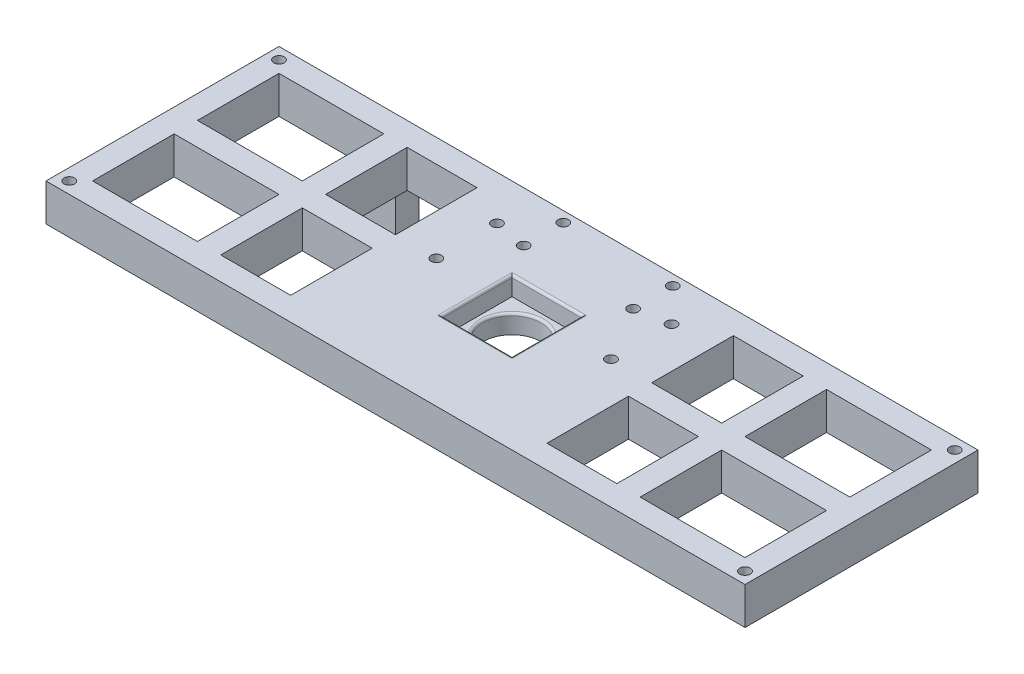
from build123d import *

# Parameters (mm, degrees)
SKETCH_1_W           = 300
SKETCH_1_H           = 100
EXTRUDE_1_DEPTH      = 16
SKETCH_2_W           = 30
SKETCH_2_H           = 30
CUT_EXTRUDE_1_DEPTH  = 8
SKETCH_3_R           = 12.5
CUT_EXTRUDE_2_DEPTH  = 14
CUT_EXTRUDE_3_REACH  = 318.632
SKETCH_4_W           = 50
SKETCH_4_H           = 35
SKETCH_7_W           = 35
SKETCH_7_H           = 16
EXTRUDE_2_DEPTH      = 20
SKETCH_8_W           = 35
SKETCH_8_H           = 16
EXTRUDE_3_DEPTH      = 20
SKETCH_9_W           = 20
SKETCH_9_H           = 10
EXTRUDE_4_DEPTH      = 25
FILLET_1_R           = 1
FILLET_2_R           = 1
SKETCH_13_W          = 35
SKETCH_13_H          = 16
EXTRUDE_6_DEPTH      = 4
SKETCH_14_W          = 35
SKETCH_14_H          = 16
EXTRUDE_7_DEPTH      = 4
SKETCH_17_W          = 35
SKETCH_17_H          = 16
EXTRUDE_8_DEPTH      = 1
SKETCH_18_W          = 35
SKETCH_18_H          = 16
EXTRUDE_9_DEPTH      = 1
SKETCH_19_R          = 2.25
CUT_EXTRUDE_8_DEPTH  = 5
CUT_EXTRUDE_START    = -5
SKETCH_20_R          = 2.25
CUT_EXTRUDE_9_DEPTH  = 5
SKETCH_21_R          = 1.45
CUT_EXTRUDE_10_DEPTH = 5
SKETCH_22_R          = 2.25
CUT_EXTRUDE_11_DEPTH = 5
SKETCH_23_R          = 1.45
CUT_EXTRUDE_12_DEPTH = 5
SKETCH_24_R          = 2.25
CUT_EXTRUDE_13_DEPTH = 5


with BuildPart() as part:
    # 草图1 → 凸台-拉伸1 (new body)
    with BuildSketch(Plane(origin=(0, 0, 0), x_dir=(1, 0, 0), z_dir=(0, 1, 0))):
        with Locations((-150, 50)):
            Rectangle(SKETCH_1_W, SKETCH_1_H)
    extrude(amount=EXTRUDE_1_DEPTH)

    # 草图2 → 切除-拉伸1 (cut)
    with BuildSketch(Plane(origin=(0, 16, 0), x_dir=(1, 0, 0), z_dir=(0, 1, 0))):
        with Locations((-150, 50)):
            Rectangle(SKETCH_2_W, SKETCH_2_H)
    extrude(amount=-CUT_EXTRUDE_1_DEPTH, mode=Mode.SUBTRACT)

    # 草图3 → 切除-拉伸2 (cut)
    with BuildSketch(Plane(origin=(0, 8, 0), x_dir=(1, 0, 0), z_dir=(0, 1, 0))):
        with Locations(Location((-150, 50, 0), (0, 0, 270))):
            Circle(SKETCH_3_R)
    extrude(amount=-CUT_EXTRUDE_2_DEPTH, mode=Mode.SUBTRACT)

    # 草图4 → 切除-拉伸3 (cut, up to next)
    with BuildSketch(Plane(origin=(0, 16, 0), x_dir=(1, 0, 0), z_dir=(0, 1, 0)), mode=Mode.PRIVATE) as cut_extrude_3_sk1:
        with Locations((-270, 72.5)):
            Rectangle(SKETCH_4_W, SKETCH_4_H)
    cut_extrude_3_tool1 = extrude(cut_extrude_3_sk1.sketch, amount=-CUT_EXTRUDE_3_REACH, mode=Mode.PRIVATE) & part.part
    # 草图4 → 切除-拉伸3 (cut, up to next)
    with BuildSketch(Plane(origin=(0, 16, 0), x_dir=(1, 0, 0), z_dir=(0, 1, 0)), mode=Mode.PRIVATE) as cut_extrude_3_sk2:
        with Locations((-270, 27.5)):
            Rectangle(SKETCH_4_W, SKETCH_4_H)
    cut_extrude_3_tool2 = extrude(cut_extrude_3_sk2.sketch, amount=-CUT_EXTRUDE_3_REACH, mode=Mode.PRIVATE) & part.part
    # 草图4 → 切除-拉伸3 (cut, up to next)
    with BuildSketch(Plane(origin=(0, 16, 0), x_dir=(1, 0, 0), z_dir=(0, 1, 0)), mode=Mode.PRIVATE) as cut_extrude_3_sk3:
        with Locations((-210, 72.5)):
            Rectangle(SKETCH_4_W, SKETCH_4_H)
    cut_extrude_3_tool3 = extrude(cut_extrude_3_sk3.sketch, amount=-CUT_EXTRUDE_3_REACH, mode=Mode.PRIVATE) & part.part
    # 草图4 → 切除-拉伸3 (cut, up to next)
    with BuildSketch(Plane(origin=(0, 16, 0), x_dir=(1, 0, 0), z_dir=(0, 1, 0)), mode=Mode.PRIVATE) as cut_extrude_3_sk4:
        with Locations((-210, 27.5)):
            Rectangle(SKETCH_4_W, SKETCH_4_H)
    cut_extrude_3_tool4 = extrude(cut_extrude_3_sk4.sketch, amount=-CUT_EXTRUDE_3_REACH, mode=Mode.PRIVATE) & part.part
    # 草图4 → 切除-拉伸3 (cut, up to next)
    with BuildSketch(Plane(origin=(0, 16, 0), x_dir=(1, 0, 0), z_dir=(0, 1, 0)), mode=Mode.PRIVATE) as cut_extrude_3_sk5:
        with Locations((-30, 27.5)):
            Rectangle(SKETCH_4_W, SKETCH_4_H)
    cut_extrude_3_tool5 = extrude(cut_extrude_3_sk5.sketch, amount=-CUT_EXTRUDE_3_REACH, mode=Mode.PRIVATE) & part.part
    # 草图4 → 切除-拉伸3 (cut, up to next)
    with BuildSketch(Plane(origin=(0, 16, 0), x_dir=(1, 0, 0), z_dir=(0, 1, 0)), mode=Mode.PRIVATE) as cut_extrude_3_sk6:
        with Locations((-90, 27.5)):
            Rectangle(SKETCH_4_W, SKETCH_4_H)
    cut_extrude_3_tool6 = extrude(cut_extrude_3_sk6.sketch, amount=-CUT_EXTRUDE_3_REACH, mode=Mode.PRIVATE) & part.part
    # 草图4 → 切除-拉伸3 (cut, up to next)
    with BuildSketch(Plane(origin=(0, 16, 0), x_dir=(1, 0, 0), z_dir=(0, 1, 0)), mode=Mode.PRIVATE) as cut_extrude_3_sk7:
        with Locations((-90, 72.5)):
            Rectangle(SKETCH_4_W, SKETCH_4_H)
    cut_extrude_3_tool7 = extrude(cut_extrude_3_sk7.sketch, amount=-CUT_EXTRUDE_3_REACH, mode=Mode.PRIVATE) & part.part
    # 草图4 → 切除-拉伸3 (cut, up to next)
    with BuildSketch(Plane(origin=(0, 16, 0), x_dir=(1, 0, 0), z_dir=(0, 1, 0)), mode=Mode.PRIVATE) as cut_extrude_3_sk8:
        with Locations((-30, 72.5)):
            Rectangle(SKETCH_4_W, SKETCH_4_H)
    cut_extrude_3_tool8 = extrude(cut_extrude_3_sk8.sketch, amount=-CUT_EXTRUDE_3_REACH, mode=Mode.PRIVATE) & part.part
    add(cut_extrude_3_tool1.solids().sort_by_distance((-270, 16, -72.5))[0], mode=Mode.SUBTRACT)
    add(cut_extrude_3_tool2.solids().sort_by_distance((-270, 16, -27.5))[0], mode=Mode.SUBTRACT)
    add(cut_extrude_3_tool3.solids().sort_by_distance((-210, 16, -72.5))[0], mode=Mode.SUBTRACT)
    add(cut_extrude_3_tool4.solids().sort_by_distance((-210, 16, -27.5))[0], mode=Mode.SUBTRACT)
    add(cut_extrude_3_tool5.solids().sort_by_distance((-30, 16, -27.5))[0], mode=Mode.SUBTRACT)
    add(cut_extrude_3_tool6.solids().sort_by_distance((-90, 16, -27.5))[0], mode=Mode.SUBTRACT)
    add(cut_extrude_3_tool7.solids().sort_by_distance((-90, 16, -72.5))[0], mode=Mode.SUBTRACT)
    add(cut_extrude_3_tool8.solids().sort_by_distance((-30, 16, -72.5))[0], mode=Mode.SUBTRACT)

    # 草图7 → 凸台-拉伸2 (add)
    with BuildSketch(Plane.ZY.offset(185)):
        with Locations((-27.5, 8)):
            Rectangle(SKETCH_7_W, SKETCH_7_H)
        with Locations((-72.5, 8)):
            Rectangle(SKETCH_7_W, SKETCH_7_H)
    extrude(amount=EXTRUDE_2_DEPTH)

    # 草图8 → 凸台-拉伸3 (add)
    with BuildSketch(Plane(origin=(-115, 0, 0), x_dir=(0, 0, -1), z_dir=(1, 0, 0))):
        with Locations((27.5, 8)):
            Rectangle(SKETCH_8_W, SKETCH_8_H)
        with Locations((72.5, 8)):
            Rectangle(SKETCH_8_W, SKETCH_8_H)
    extrude(amount=EXTRUDE_3_DEPTH)

    # 草图9 → 凸台-拉伸4 (add)
    with BuildSketch(Plane.XZ):
        with Locations((-250, -95)):
            Rectangle(SKETCH_9_W, SKETCH_9_H)
    extrude(amount=EXTRUDE_4_DEPTH)

    # 圆角1
    fillet_1_edges = [part.edges().sort_by_distance(p)[0] for p in [
        (-150, 8, -62.5),
    ]]
    fillet(fillet_1_edges, radius=FILLET_1_R)

    # 圆角2
    fillet_2_edges = [part.edges().sort_by_distance(p)[0] for p in [
        (-135, 16, -50),
        (-150, 16, -65),
        (-165, 16, -50),
        (-150, 16, -35),
    ]]
    fillet(fillet_2_edges, radius=FILLET_2_R)

    # 草图13 → 凸台-拉伸6 (add)
    with BuildSketch(Plane.ZY.offset(5)):
        with Locations((-72.5, 8)):
            Rectangle(SKETCH_13_W, SKETCH_13_H)
        with Locations((-27.5, 8)):
            Rectangle(SKETCH_13_W, SKETCH_13_H)
    extrude(amount=EXTRUDE_6_DEPTH)

    # 草图14 → 凸台-拉伸7 (add)
    with BuildSketch(Plane(origin=(-295, 0, 0), x_dir=(0, 0, -1), z_dir=(1, 0, 0))):
        with Locations((72.5, 8)):
            Rectangle(SKETCH_14_W, SKETCH_14_H)
        with Locations((27.5, 8)):
            Rectangle(SKETCH_14_W, SKETCH_14_H)
    extrude(amount=EXTRUDE_7_DEPTH)

    # 草图17 → 凸台-拉伸8 (add)
    with BuildSketch(Plane(origin=(-291, 0, 0), x_dir=(0, 0, -1), z_dir=(1, 0, 0))):
        with Locations((27.5, 8)):
            Rectangle(SKETCH_17_W, SKETCH_17_H)
        with Locations((72.5, 8)):
            Rectangle(SKETCH_17_W, SKETCH_17_H)
    extrude(amount=EXTRUDE_8_DEPTH)

    # 草图18 → 凸台-拉伸9 (add)
    with BuildSketch(Plane.ZY.offset(9)):
        with Locations((-27.5, 8)):
            Rectangle(SKETCH_18_W, SKETCH_18_H)
        with Locations((-72.5, 8)):
            Rectangle(SKETCH_18_W, SKETCH_18_H)
    extrude(amount=EXTRUDE_9_DEPTH)

    # 草图19 → 切除-拉伸8 (cut)
    with BuildSketch(Plane(origin=(0, 16, 0), x_dir=(1, 0, 0), z_dir=(0, 1, 0))):
        with Locations(Location((-295, 95, 0), (0, 0, 270))):
            Circle(SKETCH_19_R)
        with Locations(Location((-295, 5, 0), (0, 0, 90))):
            Circle(SKETCH_19_R)
        with Locations(Location((-5, 5, 0), (0, 0, 270))):
            Circle(SKETCH_19_R)
        with Locations(Location((-5, 95, 0), (0, 0, 90))):
            Circle(SKETCH_19_R)
    extrude(amount=-CUT_EXTRUDE_8_DEPTH, mode=Mode.SUBTRACT)

    # 草图20 → 切除-拉伸9 (cut)
    with BuildSketch(Plane.XZ.offset(CUT_EXTRUDE_START)):
        with Locations(Location((-295, -95, 0), (0, 0, 90))):
            Circle(SKETCH_20_R)
        with Locations(Location((-295, -5, 0), (0, 0, 270))):
            Circle(SKETCH_20_R)
        with Locations(Location((-5, -95, 0), (0, 0, 270))):
            Circle(SKETCH_20_R)
        with Locations(Location((-5, -5, 0), (0, 0, 90))):
            Circle(SKETCH_20_R)
    extrude(amount=CUT_EXTRUDE_9_DEPTH, mode=Mode.SUBTRACT)

    # 草图21 → 切除-拉伸10 (cut)
    with BuildSketch(Plane(origin=(-100.276222054, 16, -200.091791604), x_dir=(-0.00184091553368713, 0, -0.9999983055135633), z_dir=(0, 1, 0))):
        with Locations(Location((-104.543338614, 26.416278164, 0), (0, 0, 179.89452325))):
            Circle(SKETCH_21_R)
        with Locations(Location((-121.543309808, 26.447573728, 0), (0, 0, 179.89452325))):
            Circle(SKETCH_21_R)
        with Locations(Location((-121.456786778, 73.447494087, 0), (0, 0, 179.89452325))):
            Circle(SKETCH_21_R)
        with Locations(Location((-104.456815584, 73.416198523, 0), (0, 0, 179.89452325))):
            Circle(SKETCH_21_R)
    extrude(amount=-CUT_EXTRUDE_10_DEPTH, mode=Mode.SUBTRACT)

    # 草图22 → 切除-拉伸11 (cut)
    with BuildSketch(Plane(origin=(0, 16, 0), x_dir=(1, 0, 0), z_dir=(0, 1, 0))):
        with Locations(Location((-173.5, 95.5, 0), (0, 0, 270))):
            Circle(SKETCH_22_R)
        with Locations(Location((-173.5, 78.5, 0), (0, 0, 270))):
            Circle(SKETCH_22_R)
        with Locations(Location((-126.5, 95.5, 0), (0, 0, 270))):
            Circle(SKETCH_22_R)
        with Locations(Location((-126.5, 78.5, 0), (0, 0, 270))):
            Circle(SKETCH_22_R)
    extrude(amount=-CUT_EXTRUDE_11_DEPTH, mode=Mode.SUBTRACT)

    # 草图23 → 切除-拉伸12 (cut)
    with BuildSketch(Plane(origin=(-100.276222054, 16, -200.091791604), x_dir=(-0.00184091553368713, 0, -0.9999983055135633), z_dir=(0, 1, 0))):
        with Locations(Location((-119.069051565, 12.462168574, 0), (0, 0, 179.89452325))):
            Circle(SKETCH_23_R)
        with Locations(Location((-145.069007508, 12.510032378, 0), (0, 0, 179.89452325))):
            Circle(SKETCH_23_R)
        with Locations(Location((-144.931009437, 87.471558467, 0), (0, 0, 179.89452325))):
            Circle(SKETCH_23_R)
        with Locations(Location((-118.931053493, 87.423694663, 0), (0, 0, 179.89452325))):
            Circle(SKETCH_23_R)
    extrude(amount=-CUT_EXTRUDE_12_DEPTH, mode=Mode.SUBTRACT)

    # 草图24 → 切除-拉伸13 (cut)
    with BuildSketch(Plane(origin=(0, 16, 0), x_dir=(1, 0, 0), z_dir=(0, 1, 0))):
        with Locations(Location((-187.480826555, 81, 0), (0, 0, 270))):
            Circle(SKETCH_24_R)
        with Locations(Location((-187.480826555, 55, 0), (0, 0, 270))):
            Circle(SKETCH_24_R)
        with Locations(Location((-112.519173445, 81, 0), (0, 0, 270))):
            Circle(SKETCH_24_R)
        with Locations(Location((-112.519173445, 55, 0), (0, 0, 270))):
            Circle(SKETCH_24_R)
    extrude(amount=-CUT_EXTRUDE_13_DEPTH, mode=Mode.SUBTRACT)


solid = part.part
